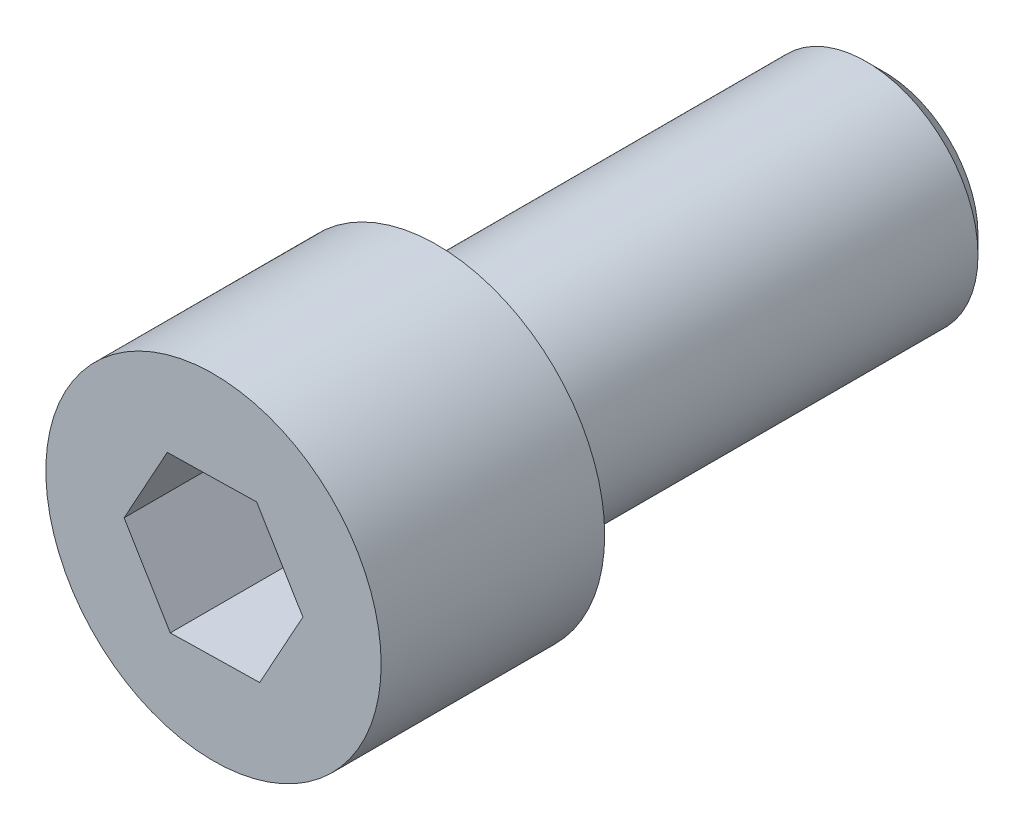
from build123d import *

# Parameters (mm, degrees)
SKETCH1_R           = 4.7625
BOSS_EXTRUDE1_DEPTH = 6.35
CUT_EXTRUDE1_DEPTH  = 3.81
SKETCH3_R           = 3.175
BOSS_EXTRUDE2_DEPTH = 12.7
FILLET1_R           = 0.381
CHAMFER1_SIZE       = 0.508


with BuildPart() as part:
    # Sketch1 → Boss-Extrude1 (new body)
    with BuildSketch(Plane.XY):
        with Locations((-30.092415064, 3.614452089)):
            Circle(SKETCH1_R)
    extrude(amount=BOSS_EXTRUDE1_DEPTH)

    # Sketch2 → Cut-Extrude1 (cut)
    with BuildSketch(Plane.XY.offset(6.35)):
        Polygon((-28.780253739, 1.439634244), (-27.552886899, 3.663408208), (-28.865048224, 5.838226052), (-31.404576389, 5.789269933), (-32.631943228, 3.56549597), (-31.319781903, 1.390678125), align=None)
    extrude(amount=-CUT_EXTRUDE1_DEPTH, mode=Mode.SUBTRACT)

    # Sketch3 → Boss-Extrude2 (add)
    with BuildSketch(Plane(origin=(0, 0, 0), x_dir=(-1, 0, 0), z_dir=(0, 0, -1))):
        with Locations((30.092415064, 3.614452089)):
            Circle(SKETCH3_R)
    extrude(amount=BOSS_EXTRUDE2_DEPTH)

    # Fillet1
    fillet1_edges = [part.edges().sort_by_distance(p)[0] for p in [
        (-26.917415064, 3.614452089, 0),
    ]]
    fillet(fillet1_edges, radius=FILLET1_R)

    # Chamfer1
    chamfer1_edges = [part.edges().sort_by_distance(p)[0] for p in [
        (-26.917415064, 3.614452089, -12.7),
    ]]
    chamfer(chamfer1_edges, length=CHAMFER1_SIZE)


solid = part.part
